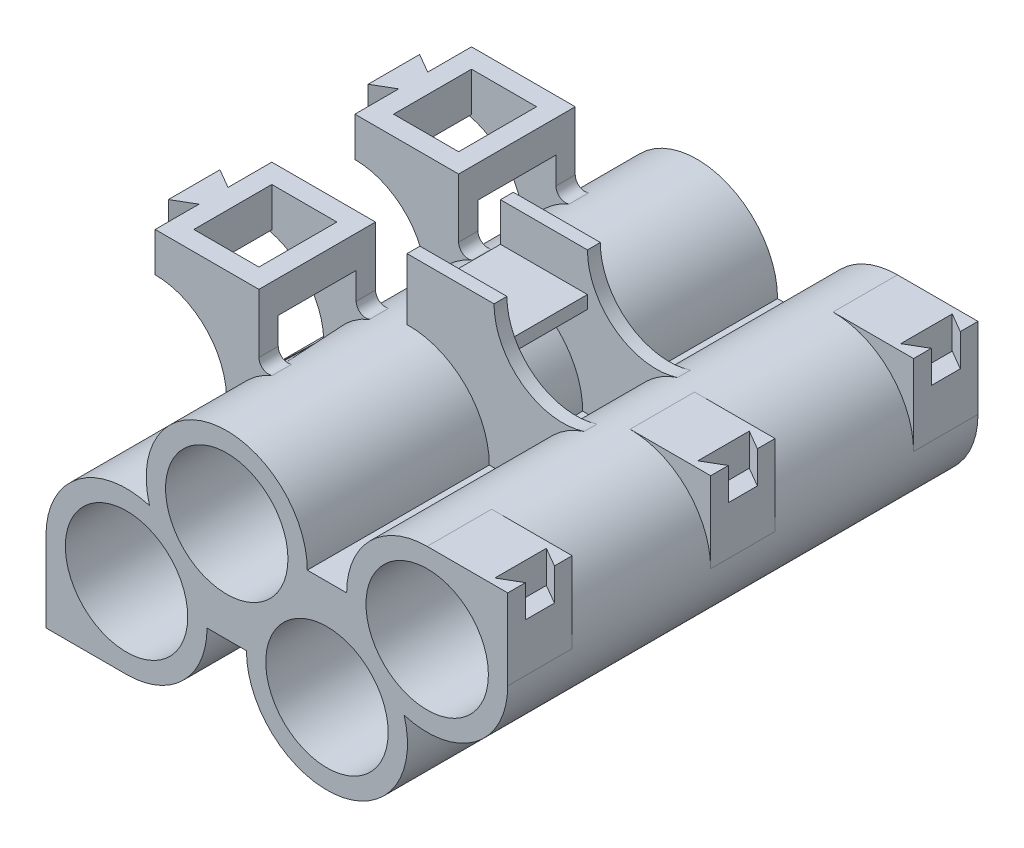
from build123d import *

# Parameters (mm, degrees)
SKETCH_1_R          = 9.5
EXTRUDE_2_DEPTH     = 73
EXTRUDE_START       = -3
EXTRUDE_3_DEPTH     = 3
EXTRUDE_4_DEPTH     = 3
EXTRUDE_5_DEPTH     = 3
EXTRUDE_6_DEPTH     = 3
SKETCH_8_W          = 3
SKETCH_8_H          = 6.1
EXTRUDE_7_DEPTH     = 12.1
SKETCH_9_W          = 3
SKETCH_9_H          = 6.1
EXTRUDE_8_DEPTH     = 12.1
SKETCH_10_W         = 3
SKETCH_10_H         = 5
EXTRUDE_9_DEPTH     = 12.1
SKETCH_11_W         = 3
SKETCH_11_H         = 5
EXTRUDE_10_DEPTH    = 12.1
EXTRUDE_11_DEPTH    = 3
EXTRUDE_12_DEPTH    = 3
EXTRUDE_13_DEPTH    = 3
EXTRUDE_14_DEPTH    = 3
EXTRUDE_15_DEPTH    = 6.1
SKETCH_18_W         = 13.5
SKETCH_18_H         = 6
EXTRUDE_16_DEPTH    = 2
EXTRUDE_START_2     = -2
SKETCH_19_W         = 13.5
SKETCH_19_H         = 6
EXTRUDE_17_DEPTH    = 2
SKETCH_20_W         = 13.5
SKETCH_20_H         = 2
EXTRUDE_18_DEPTH    = 12.5
EXTRUDE_START_3     = -10
EXTRUDE_19_DEPTH    = 10
EXTRUDE_20_DEPTH    = 10
EXTRUDE_START_4     = 36.5
EXTRUDE_21_DEPTH    = 5
CUT_EXTRUDE_1_DEPTH = 5


with BuildPart() as part:
    # Эскиз1 → Бобышка-Вытянуть2 (new body)
    with BuildSketch(Plane.XY):
        with BuildLine():
            Line((-28.056349186, -15.556349186), (-28.056349186, -28.056349186))
            Line((-28.056349186, -28.056349186), (-15.556349186, -28.056349186))
            ThreePointArc((-15.556349186, -28.056349186), (-6.717514421, -24.395183951), (-3.056349186, -15.556349186))
            Line((-3.056349186, -15.556349186), (3.056349186, -15.556349186))
            ThreePointArc((3.056349186, -15.556349186), (17.365374305, -27.924753615), (27.532737685, -11.976388499))
            ThreePointArc((27.532737685, -11.976388499), (41.137654945, 7.466608715), (18.612698372, 0))
            Line((18.612698372, 0), (12.5, 0))
            ThreePointArc((12.5, 0), (-1.809025119, 12.368404429), (-11.976388499, -3.579960687))
            ThreePointArc((-11.976388499, -3.579960687), (-23.022957901, -5.531392613), (-28.056349186, -15.556349186))
        make_face()
        with Locations((-15.556349186, -15.556349186)):
            Circle(SKETCH_1_R, mode=Mode.SUBTRACT)
        with Locations((15.556349186, -15.556349186)):
            Circle(SKETCH_1_R, mode=Mode.SUBTRACT)
        Circle(SKETCH_1_R, mode=Mode.SUBTRACT)
        with Locations((31.112698372, 0)):
            Circle(SKETCH_1_R, mode=Mode.SUBTRACT)
    extrude(amount=EXTRUDE_2_DEPTH)

    # Эскиз4 → Бобышка-Вытянуть3 (add)
    with BuildSketch(Plane.XY.offset(61.05).offset(EXTRUDE_START)):
        with BuildLine():
            ThreePointArc((-12.229391425, 2.586887198), (-10.355088747, 7.001581039), (-6.956349186, 10.385528682))
            Line((-6.956349186, 10.385528682), (-6.956349186, 22.043650814))
            Line((-6.956349186, 22.043650814), (-23.056349186, 22.043650814))
            Line((-23.056349186, 22.043650814), (-23.056349186, 15.943650814))
            ThreePointArc((-23.056349186, 15.943650814), (-15.231128181, 12.702338145), (-11.989815512, 4.87711714))
            ThreePointArc((-11.989815512, 4.87711714), (-12.049872452, 3.725753839), (-12.229391425, 2.586887198))
        make_face()
    extrude(amount=EXTRUDE_3_DEPTH)

    # Эскиз5 → Бобышка-Вытянуть4 (add)
    with BuildSketch(Plane.XY.offset(11.95)):
        with BuildLine():
            ThreePointArc((-12.229391425, 2.586887198), (-10.355088747, 7.001581039), (-6.956349186, 10.385528682))
            Line((-6.956349186, 10.385528682), (-6.956349186, 22.043650814))
            Line((-6.956349186, 22.043650814), (-23.056349186, 22.043650814))
            Line((-23.056349186, 22.043650814), (-23.056349186, 15.943650814))
            ThreePointArc((-23.056349186, 15.943650814), (-15.231128181, 12.702338145), (-11.989815512, 4.87711714))
            ThreePointArc((-11.989815512, 4.87711714), (-12.049872452, 3.725753839), (-12.229391425, 2.586887198))
        make_face()
    extrude(amount=EXTRUDE_4_DEPTH)

    # Эскиз7 → Бобышка-Вытянуть6 (add)
    with BuildSketch(Plane.XY.offset(30.05).offset(EXTRUDE_START)):
        with BuildLine():
            ThreePointArc((-12.229391425, 2.586887198), (-10.355088747, 7.001581039), (-6.956349186, 10.385528682))
            Line((-6.956349186, 10.385528682), (-6.956349186, 22.043650814))
            Line((-6.956349186, 22.043650814), (-23.056349186, 22.043650814))
            Line((-23.056349186, 22.043650814), (-23.056349186, 15.943650814))
            ThreePointArc((-23.056349186, 15.943650814), (-15.231128181, 12.702338145), (-11.989815512, 4.87711714))
            ThreePointArc((-11.989815512, 4.87711714), (-12.049872452, 3.725753839), (-12.229391425, 2.586887198))
        make_face()
    extrude(amount=EXTRUDE_6_DEPTH)

    # Эскиз8 → Бобышка-Вытянуть7 (add)
    with BuildSketch(Plane.XY.offset(14.95)):
        with Locations((-21.556349186, 18.993650814)):
            Rectangle(SKETCH_8_W, SKETCH_8_H)
    extrude(amount=EXTRUDE_7_DEPTH)



with BuildPart() as body_2:
    # Эскиз6 → Бобышка-Вытянуть5 (new body)
    with BuildSketch(Plane.XY.offset(42.95)):
        with BuildLine():
            ThreePointArc((-12.229391425, 2.586887198), (-10.355088747, 7.001581039), (-6.956349186, 10.385528682))
            Line((-6.956349186, 10.385528682), (-6.956349186, 22.043650814))
            Line((-6.956349186, 22.043650814), (-23.056349186, 22.043650814))
            Line((-23.056349186, 22.043650814), (-23.056349186, 15.943650814))
            ThreePointArc((-23.056349186, 15.943650814), (-15.231128181, 12.702338145), (-11.989815512, 4.87711714))
            ThreePointArc((-11.989815512, 4.87711714), (-12.049872452, 3.725753839), (-12.229391425, 2.586887198))
        make_face()
    extrude(amount=EXTRUDE_5_DEPTH)


with BuildPart() as part_1:
    add(part.part)

    add(body_2.part)  # Бобышка-Вытянуть8 merges body 2
    # Эскиз9 → Бобышка-Вытянуть8 (add)
    with BuildSketch(Plane.XY.offset(45.95)):
        with Locations((-21.556349186, 18.993650814)):
            Rectangle(SKETCH_9_W, SKETCH_9_H)
    extrude(amount=EXTRUDE_8_DEPTH)

    # Эскиз10 → Бобышка-Вытянуть9 (add)
    with BuildSketch(Plane.XY.offset(45.95)):
        with Locations((-8.456349186, 19.543650814)):
            Rectangle(SKETCH_10_W, SKETCH_10_H)
    extrude(amount=EXTRUDE_9_DEPTH)

    # Эскиз11 → Бобышка-Вытянуть10 (add)
    with BuildSketch(Plane(origin=(0, 0, 27.05), x_dir=(-1, 0, 0), z_dir=(0, 0, -1))):
        with Locations((8.456349186, 19.543650814)):
            Rectangle(SKETCH_11_W, SKETCH_11_H)
    extrude(amount=EXTRUDE_10_DEPTH)

    # Эскиз12 → Бобышка-Вытянуть11 (add)
    with BuildSketch(Plane(origin=(0, 0, 11.95), x_dir=(-1, 0, 0), z_dir=(0, 0, -1))):
        with BuildLine():
            Line((6.956349186, 10.385528682), (6.956349186, 12.89295364))
            ThreePointArc((6.956349186, 12.89295364), (6.284928313, 11.642571046), (4.871740345, 11.51156575))
            ThreePointArc((4.871740345, 11.51156575), (5.940784069, 10.998049129), (6.956349186, 10.385528682))
        make_face()
    extrude(amount=-EXTRUDE_11_DEPTH)

    # Эскиз13 → Бобышка-Вытянуть12 (add)
    with BuildSketch(Plane(origin=(0, 0, 27.05), x_dir=(-1, 0, 0), z_dir=(0, 0, -1))):
        with BuildLine():
            Line((6.956349186, 10.385528682), (6.956349186, 12.89295364))
            ThreePointArc((6.956349186, 12.89295364), (6.284928313, 11.642571046), (4.871740345, 11.51156575))
            ThreePointArc((4.871740345, 11.51156575), (5.940784069, 10.998049129), (6.956349186, 10.385528682))
        make_face()
    extrude(amount=-EXTRUDE_12_DEPTH)

    # Эскиз14 → Бобышка-Вытянуть13 (add)
    with BuildSketch(Plane(origin=(0, 0, 42.95), x_dir=(-1, 0, 0), z_dir=(0, 0, -1))):
        with BuildLine():
            Line((6.956349186, 10.385528682), (6.956349186, 12.89295364))
            ThreePointArc((6.956349186, 12.89295364), (6.284928313, 11.642571046), (4.871740345, 11.51156575))
            ThreePointArc((4.871740345, 11.51156575), (5.940784069, 10.998049129), (6.956349186, 10.385528682))
        make_face()
    extrude(amount=-EXTRUDE_13_DEPTH)

    # Эскиз15 → Бобышка-Вытянуть14 (add)
    with BuildSketch(Plane(origin=(0, 0, 58.05), x_dir=(-1, 0, 0), z_dir=(0, 0, -1))):
        with BuildLine():
            Line((6.956349186, 10.385528682), (6.956349186, 12.89295364))
            ThreePointArc((6.956349186, 12.89295364), (6.284928313, 11.642571046), (4.871740345, 11.51156575))
            ThreePointArc((4.871740345, 11.51156575), (5.940784069, 10.998049129), (6.956349186, 10.385528682))
        make_face()
    extrude(amount=-EXTRUDE_14_DEPTH)

    # Эскиз16 → Бобышка-Вытянуть15 (add)
    with BuildSketch(Plane.XZ.offset(-22.043650814)):
        Polygon((-23.056349186, 18.75), (-23.056349186, 23.25), (-26.056349186, 25), (-26.056349186, 17), align=None)
        Polygon((-23.056349186, 49.75), (-23.056349186, 54.25), (-26.056349186, 56), (-26.056349186, 48), align=None)
    extrude(amount=EXTRUDE_15_DEPTH)

    # Эскиз18 → Бобышка-Вытянуть16 (add)
    with BuildSketch(Plane.XY.offset(42.75)):
        with BuildLine():
            Line((13.237836074, 16.043650814), (-0.262163926, 16.043650814))
            Line((-0.262163926, 16.043650814), (-0.262163926, 12.497250501))
            ThreePointArc((-0.262163926, 12.497250501), (8.745654662, 8.931042746), (12.5, 0))
            Line((12.5, 0), (18.612698372, 0))
            ThreePointArc((18.612698372, 0), (20.996031333, 7.341869518), (27.237186055, 11.884039897))
            ThreePointArc((27.237186055, 11.884039897), (17.647498042, 13.394958805), (13.237836074, 22.043650814))
            Line((13.237836074, 22.043650814), (13.237836074, 16.043650814))
        make_face()
        with Locations((6.487836074, 19.043650814)):
            Rectangle(SKETCH_18_W, SKETCH_18_H)
    extrude(amount=EXTRUDE_16_DEPTH)

    # Эскиз19 → Бобышка-Вытянуть17 (add)
    with BuildSketch(Plane.XY.offset(30.25).offset(EXTRUDE_START_2)):
        with BuildLine():
            Line((13.237836074, 16.043650814), (-0.262163926, 16.043650814))
            Line((-0.262163926, 16.043650814), (-0.262163926, 12.497250501))
            ThreePointArc((-0.262163926, 12.497250501), (8.745654662, 8.931042746), (12.5, 0))
            Line((12.5, 0), (18.612698372, 0))
            ThreePointArc((18.612698372, 0), (20.996031333, 7.341869518), (27.237186055, 11.884039897))
            ThreePointArc((27.237186055, 11.884039897), (17.647498042, 13.394958805), (13.237836074, 22.043650814))
            Line((13.237836074, 22.043650814), (13.237836074, 16.043650814))
        make_face()
        with Locations((6.487836074, 19.043650814)):
            Rectangle(SKETCH_19_W, SKETCH_19_H)
    extrude(amount=EXTRUDE_17_DEPTH)

    # Эскиз20 → Бобышка-Вытянуть18 (add)
    with BuildSketch(Plane(origin=(0, 0, 42.75), x_dir=(-1, 0, 0), z_dir=(0, 0, -1))):
        with Locations((-6.487836074, 15.043650814)):
            Rectangle(SKETCH_20_W, SKETCH_20_H)
    extrude(amount=EXTRUDE_18_DEPTH)

    # Эскиз22 → Бобышка-Вытянуть19 (add)
    with BuildSketch(Plane.XY.offset(73).offset(EXTRUDE_START_3)):
        with BuildLine():
            Line((31.112698372, 12.5), (43.612698372, 12.5))
            Line((43.612698372, 12.5), (43.612698372, 0))
            ThreePointArc((43.612698372, 0), (39.951533137, 8.838834765), (31.112698372, 12.5))
        make_face()
    extrude(amount=EXTRUDE_19_DEPTH)

    # Эскиз23 → Бобышка-Вытянуть20 (add)
    with BuildSketch(Plane.XY):
        with BuildLine():
            Line((43.612698372, 12.5), (31.112698372, 12.5))
            ThreePointArc((31.112698372, 12.5), (39.951533137, 8.838834765), (43.612698372, 0))
            Line((43.612698372, 0), (43.612698372, 12.5))
        make_face()
    extrude(amount=EXTRUDE_20_DEPTH)

    # Эскиз24 → Бобышка-Вытянуть21 (add, symmetric)
    with BuildSketch(Plane.XY.offset(EXTRUDE_START_4)):
        with BuildLine():
            Line((43.612698372, 12.5), (31.112698372, 12.5))
            ThreePointArc((31.112698372, 12.5), (39.951533137, 8.838834765), (43.612698372, 0))
            Line((43.612698372, 0), (43.612698372, 12.5))
        make_face()
    extrude(amount=EXTRUDE_21_DEPTH, both=True)

    # Эскиз25 → Вырез-Вытянуть1 (cut)
    with BuildSketch(Plane(origin=(0, 12.5, 0), x_dir=(1, 0, 0), z_dir=(0, 1, 0))):
        Polygon((43.612698372, -65.75), (40.612698372, -64), (40.612698372, -72), (43.612698372, -70.25), align=None)
        Polygon((40.612698372, -32.5), (43.612698372, -34.25), (43.612698372, -38.75), (40.612698372, -40.5), align=None)
        Polygon((43.612698372, -2.75), (43.612698372, -7.25), (40.612698372, -9), (40.612698372, -1), align=None)
    extrude(amount=-CUT_EXTRUDE_1_DEPTH, mode=Mode.SUBTRACT)


solid = part_1.part
